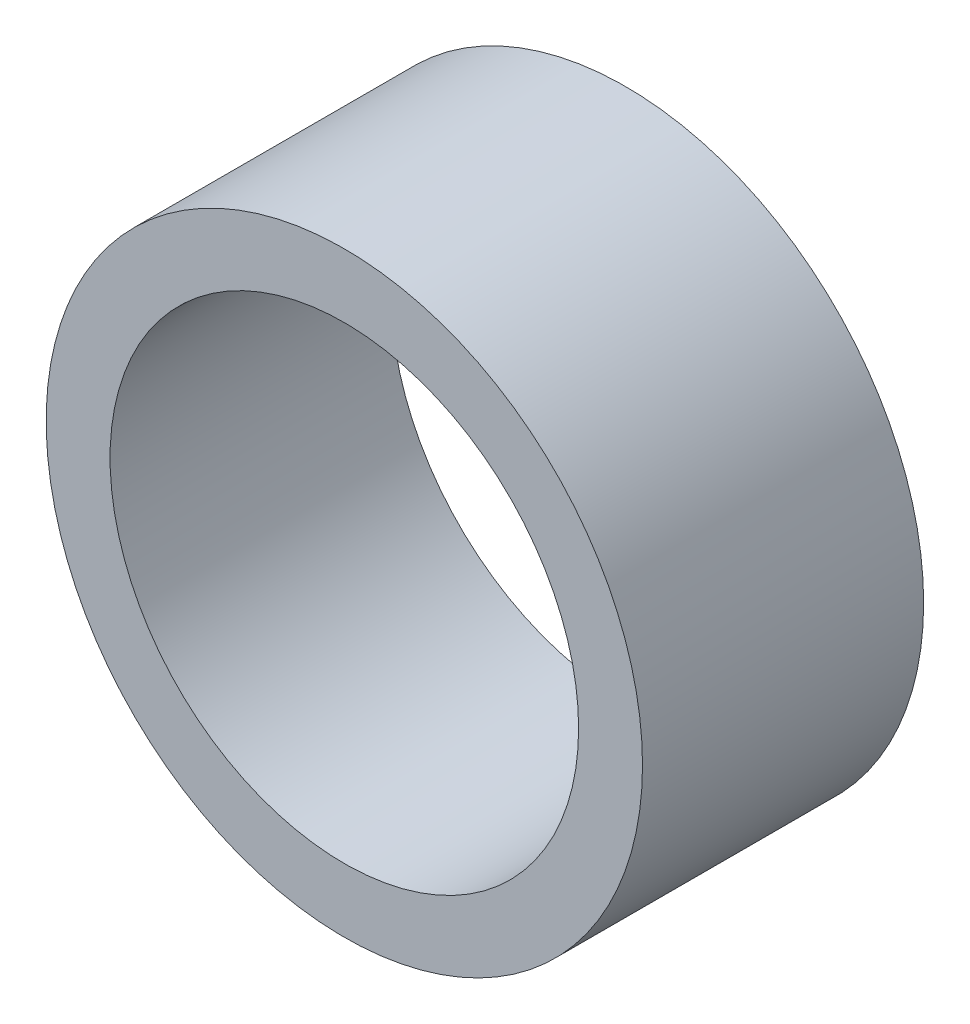
from build123d import *

# Parameters (mm, degrees)
SZKIC1_R                    = 14
SZKIC1_R_2                  = 11
DODANIE_WYCI_GNI_CIE1_DEPTH = 13.2


with BuildPart() as part:
    # Szkic1 → Dodanie-wyciągnięcie1 (new body)
    with BuildSketch(Plane.XY):
        Circle(SZKIC1_R)
        Circle(SZKIC1_R_2, mode=Mode.SUBTRACT)
    extrude(amount=DODANIE_WYCI_GNI_CIE1_DEPTH)


solid = part.part
